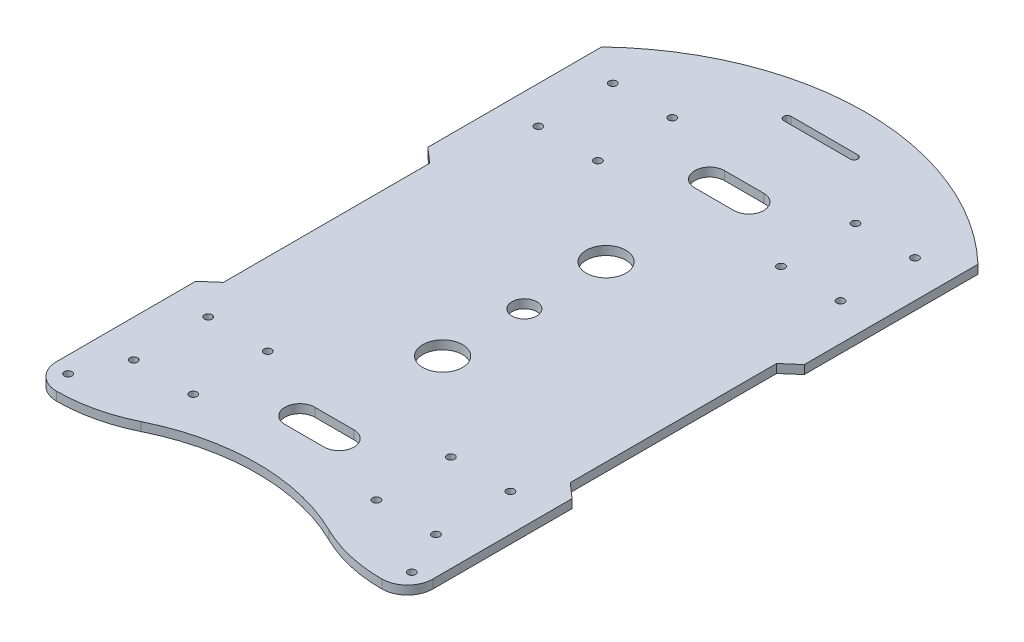
from build123d import *

# Parameters (mm, degrees)
CROQUIS1_R              = 8
CROQUIS1_R_2            = 1.55
SALIENTE_EXTRUIR1_DEPTH = 3.5
CROQUIS2_R              = 1.55
CORTAR_EXTRUIR1_DEPTH   = 157.957648109
CROQUIS3_R              = 5
CORTAR_EXTRUIR2_DEPTH   = 10


with BuildPart() as part:
    # Croquis1 → Saliente-Extruir1 (new body)
    with BuildSketch(Plane(origin=(0, 0, 0), x_dir=(1, 0, 0), z_dir=(0, 1, 0))):
        with BuildLine():
            Line((-75.83, 106.96), (-75.83, 36.96))
            Line((-75.83, 36.96), (-69.88, 31.76))
            Line((-69.88, 31.76), (-69.88, -51.39))
            Line((-69.88, -51.39), (-75.83, -56.59))
            Line((-75.83, -56.59), (-75.83, -112.67))
            ThreePointArc((-75.83, -112.67), (-72.813199846, -119.953199846), (-65.53, -122.97))
            ThreePointArc((-65.53, -122.97), (-51.316231926, -121.339014909), (-37.841336827, -116.530842982))
            ThreePointArc((-37.841336827, -116.530842982), (0, -107.730623626), (37.841336827, -116.530842982))
            ThreePointArc((37.841336827, -116.530842982), (51.316231926, -121.339014909), (65.53, -122.97))
            ThreePointArc((65.53, -122.97), (72.813199846, -119.953199846), (75.83, -112.67))
            Line((75.83, -112.67), (75.83, -56.59))
            Line((75.83, -56.59), (69.88, -51.39))
            Line((69.88, -51.39), (69.88, 31.76))
            Line((69.88, 31.76), (75.83, 36.96))
            Line((75.83, 36.96), (75.83, 106.96))
            ThreePointArc((75.83, 106.96), (0, 137.38), (-75.83, 106.96))
        make_face()
        with Locations(Location((0, 32.92, 0), (0, 0, 270))):
            Circle(CROQUIS1_R, mode=Mode.SUBTRACT)
        with Locations(Location((69.23, -114.59, 0), (0, 0, 270))):
            Circle(CROQUIS1_R_2, mode=Mode.SUBTRACT)
        with Locations(Location((0, -32.92, 0), (0, 0, 90))):
            Circle(CROQUIS1_R, mode=Mode.SUBTRACT)
        with Locations(Location((-69.23, -114.59, 0), (0, 0, 90))):
            Circle(CROQUIS1_R_2, mode=Mode.SUBTRACT)
        with BuildLine():
            Line((-7.895, -88.57), (7.895, -88.57))
            ThreePointArc((7.895, -88.57), (13.91, -82.555), (7.895, -76.54))
            Line((7.895, -76.54), (-7.895, -76.54))
            ThreePointArc((-7.895, -76.54), (-13.91, -82.555), (-7.895, -88.57))
        make_face(mode=Mode.SUBTRACT)
        with BuildLine():
            Line((-7.895, 88.57), (7.895, 88.57))
            ThreePointArc((7.895, 88.57), (13.91, 82.555), (7.895, 76.54))
            Line((7.895, 76.54), (-7.895, 76.54))
            ThreePointArc((-7.895, 76.54), (-13.91, 82.555), (-7.895, 88.57))
        make_face(mode=Mode.SUBTRACT)
        with BuildLine():
            Line((-13.415, 120.93), (13.415, 120.93))
            ThreePointArc((13.415, 120.93), (14.915, 119.43), (13.415, 117.93))
            Line((13.415, 117.93), (-13.415, 117.93))
            ThreePointArc((-13.415, 117.93), (-14.915, 119.43), (-13.415, 120.93))
        make_face(mode=Mode.SUBTRACT)
    extrude(amount=SALIENTE_EXTRUIR1_DEPTH)

    # Croquis2 → Cortar-Extruir1 (cut, through all)
    with BuildSketch(Plane(origin=(0, 3.5, 0), x_dir=(1, 0, 0), z_dir=(0, 1, 0))):
        with Locations(Location((-60.88, 66.51, 0), (0, 0, 270))):
            Circle(CROQUIS2_R)
        with Locations(Location((-60.88, 96.51, 0), (0, 0, 270))):
            Circle(CROQUIS2_R)
        with Locations(Location((-36.88, 96.51, 0), (0, 0, 270))):
            Circle(CROQUIS2_R)
        with Locations(Location((-36.88, 66.51, 0), (0, 0, 270))):
            Circle(CROQUIS2_R)
        with Locations(Location((60.88, 66.51, 0), (0, 0, 90))):
            Circle(CROQUIS2_R)
        with Locations(Location((36.88, 66.51, 0), (0, 0, 90))):
            Circle(CROQUIS2_R)
        with Locations(Location((36.88, 96.51, 0), (0, 0, 90))):
            Circle(CROQUIS2_R)
        with Locations(Location((60.88, 96.51, 0), (0, 0, 90))):
            Circle(CROQUIS2_R)
        with Locations(Location((60.88, -96.51, 0), (0, 0, 270))):
            Circle(CROQUIS2_R)
        with Locations(Location((36.88, -96.51, 0), (0, 0, 270))):
            Circle(CROQUIS2_R)
        with Locations(Location((36.88, -66.51, 0), (0, 0, 270))):
            Circle(CROQUIS2_R)
        with Locations(Location((60.88, -66.51, 0), (0, 0, 270))):
            Circle(CROQUIS2_R)
        with Locations(Location((-36.88, -66.51, 0), (0, 0, 90))):
            Circle(CROQUIS2_R)
        with Locations(Location((-36.88, -96.51, 0), (0, 0, 90))):
            Circle(CROQUIS2_R)
        with Locations(Location((-60.88, -96.51, 0), (0, 0, 90))):
            Circle(CROQUIS2_R)
        with Locations(Location((-60.88, -66.51, 0), (0, 0, 90))):
            Circle(CROQUIS2_R)
    extrude(amount=-CORTAR_EXTRUIR1_DEPTH, mode=Mode.SUBTRACT)

    # Croquis3 → Cortar-Extruir2 (cut)
    with BuildSketch(Plane(origin=(0, 3.5, 0), x_dir=(1, 0, 0), z_dir=(0, 1, 0))):
        with Locations(Location((0, 0, 0), (0, 0, 270))):
            Circle(CROQUIS3_R)
    extrude(amount=-CORTAR_EXTRUIR2_DEPTH, mode=Mode.SUBTRACT)


solid = part.part
